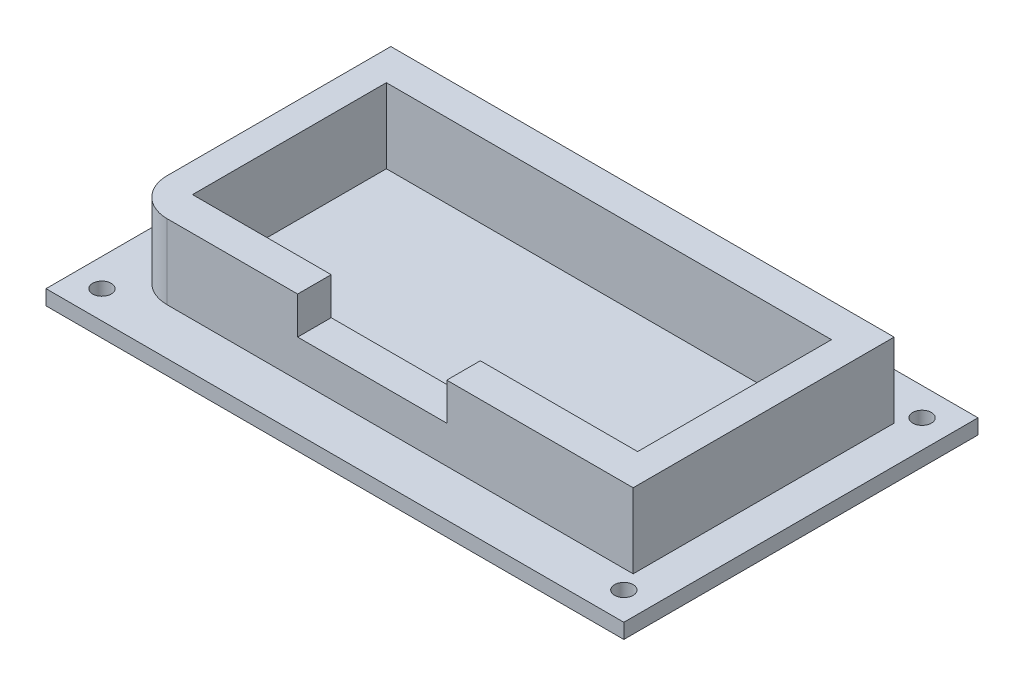
from build123d import *

# Parameters (mm, degrees)
SKETCH1_W           = 196.85
SKETCH1_H           = 120.65
SKETCH1_R           = 3.175
BOSS_EXTRUDE2_DEPTH = 5.08
SKETCH4_W           = 171.45
SKETCH4_H           = 88.9
SKETCH4_W_2         = 151.638
SKETCH4_H_2         = 66.04
BOSS_EXTRUDE3_DEPTH = 25.4
FILLET4_R           = 12.7
CUT_EXTRUDE1_REACH  = 141.032
SKETCH7_W           = 50.8
SKETCH7_H           = 12.7


with BuildPart() as part:
    # Sketch1 → Boss-Extrude2 (new body)
    with BuildSketch(Plane(origin=(0, 0, 0), x_dir=(1, 0, 0), z_dir=(0, 1, 0))):
        Rectangle(SKETCH1_W, SKETCH1_H)
        with Locations(Location((-88.9, -50.8, 0), (0, 0, 270))):
            Circle(SKETCH1_R, mode=Mode.SUBTRACT)
        with Locations(Location((88.9, -50.8, 0), (0, 0, 270))):
            Circle(SKETCH1_R, mode=Mode.SUBTRACT)
        with Locations(Location((-88.9, 50.8, 0), (0, 0, 270))):
            Circle(SKETCH1_R, mode=Mode.SUBTRACT)
        with Locations(Location((88.9, 50.8, 0), (0, 0, 270))):
            Circle(SKETCH1_R, mode=Mode.SUBTRACT)
    extrude(amount=BOSS_EXTRUDE2_DEPTH)

    # Sketch4 → Boss-Extrude3 (add)
    with BuildSketch(Plane(origin=(0, 5.08, 0), x_dir=(1, 0, 0), z_dir=(0, 1, 0))):
        Rectangle(SKETCH4_W, SKETCH4_H)
        Rectangle(SKETCH4_W_2, SKETCH4_H_2, mode=Mode.SUBTRACT)
    extrude(amount=BOSS_EXTRUDE3_DEPTH)

    # Fillet4
    fillet4_edges = [part.edges().sort_by_distance(p)[0] for p in [
        (-85.725, 17.78, 44.45),
    ]]
    fillet(fillet4_edges, radius=FILLET4_R)

    # Sketch7 → Cut-Extrude1 (cut, up to next)
    with BuildSketch(Plane(origin=(0, 0, 33.02), x_dir=(-1, 0, 0), z_dir=(0, 0, -1)), mode=Mode.PRIVATE) as cut_extrude1_sk1:
        with Locations((3.176986547, 24.13)):
            Rectangle(SKETCH7_W, SKETCH7_H)
    cut_extrude1_tool1 = extrude(cut_extrude1_sk1.sketch, amount=-CUT_EXTRUDE1_REACH, mode=Mode.PRIVATE) & part.part
    add(cut_extrude1_tool1.solids().sort_by_distance((-3.176987, 24.13, 33.02))[0], mode=Mode.SUBTRACT)


solid = part.part
